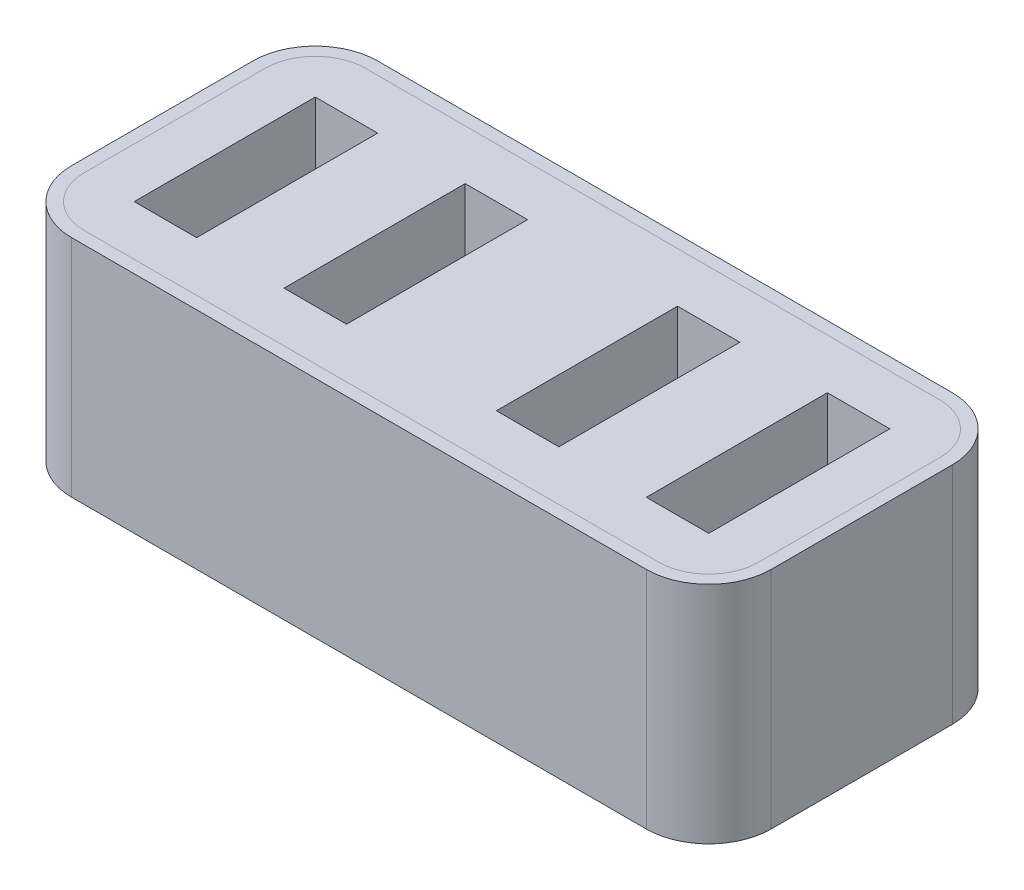
from build123d import *

# Parameters (mm, degrees)
BOSS_EXTRUDE1_DEPTH = 18
BOSS_EXTRUDE3_DEPTH = 18
CUT_EXTRUDE1_START  = 18
SKETCH2_W           = 5
SKETCH2_H           = 14.5
CUT_EXTRUDE1_DEPTH  = 10


with BuildPart() as part:
    # Sketch1 → Boss-Extrude1 (new body)
    with BuildSketch(Plane(origin=(0, 0, 0), x_dir=(1, 0, 0), z_dir=(0, 1, 0))):
        with BuildLine():
            Line((-23, 12.25), (23, 12.25))
            ThreePointArc((23, 12.25), (26.535533906, 10.785533906), (28, 7.25))
            Line((28, 7.25), (28, -7.25))
            ThreePointArc((28, -7.25), (26.535533906, -10.785533906), (23, -12.25))
            Line((23, -12.25), (-23, -12.25))
            ThreePointArc((-23, -12.25), (-26.535533906, -10.785533906), (-28, -7.25))
            Line((-28, -7.25), (-28, 7.25))
            ThreePointArc((-28, 7.25), (-26.535533906, 10.785533906), (-23, 12.25))
        make_face()
        with BuildLine():
            Line((-27, 7.25), (-27, -7.25))
            ThreePointArc((-27, -7.25), (-25.828427125, -10.078427125), (-23, -11.25))
            Line((-23, -11.25), (23, -11.25))
            ThreePointArc((23, -11.25), (25.828427125, -10.078427125), (27, -7.25))
            Line((27, -7.25), (27, 7.25))
            ThreePointArc((27, 7.25), (25.828427125, 10.078427125), (23, 11.25))
            Line((23, 11.25), (-23, 11.25))
            ThreePointArc((-23, 11.25), (-25.828427125, 10.078427125), (-27, 7.25))
        make_face(mode=Mode.SUBTRACT)
    extrude(amount=BOSS_EXTRUDE1_DEPTH)


with BuildPart() as body_2:
    # Sketch4 → Boss-Extrude3 (new body)
    with BuildSketch(Plane(origin=(0, 0, 0), x_dir=(1, 0, 0), z_dir=(0, 1, 0))):
        with BuildLine():
            Line((27, -7.25), (27, 7.25))
            ThreePointArc((27, 7.25), (25.828427125, 10.078427125), (23, 11.25))
            Line((23, 11.25), (-23, 11.25))
            ThreePointArc((-23, 11.25), (-25.828427125, 10.078427125), (-27, 7.25))
            Line((-27, 7.25), (-27, -7.25))
            ThreePointArc((-27, -7.25), (-25.828427125, -10.078427125), (-23, -11.25))
            Line((-23, -11.25), (23, -11.25))
            ThreePointArc((23, -11.25), (25.828427125, -10.078427125), (27, -7.25))
        make_face()
    extrude(amount=BOSS_EXTRUDE3_DEPTH)

    # Sketch2 → Cut-Extrude1 (cut)
    with BuildSketch(Plane(origin=(0, 0, 0), x_dir=(1, 0, 0), z_dir=(0, 1, 0)).offset(CUT_EXTRUDE1_START)):
        with Locations((-20.5, 0)):
            Rectangle(SKETCH2_W, SKETCH2_H)
        with Locations((-8.5, 0)):
            Rectangle(SKETCH2_W, SKETCH2_H)
        with Locations((20.5, 0)):
            Rectangle(SKETCH2_W, SKETCH2_H)
        with Locations((8.5, 0)):
            Rectangle(SKETCH2_W, SKETCH2_H)
    extrude(amount=-CUT_EXTRUDE1_DEPTH, mode=Mode.SUBTRACT)


solid = Compound([part.part, body_2.part])
